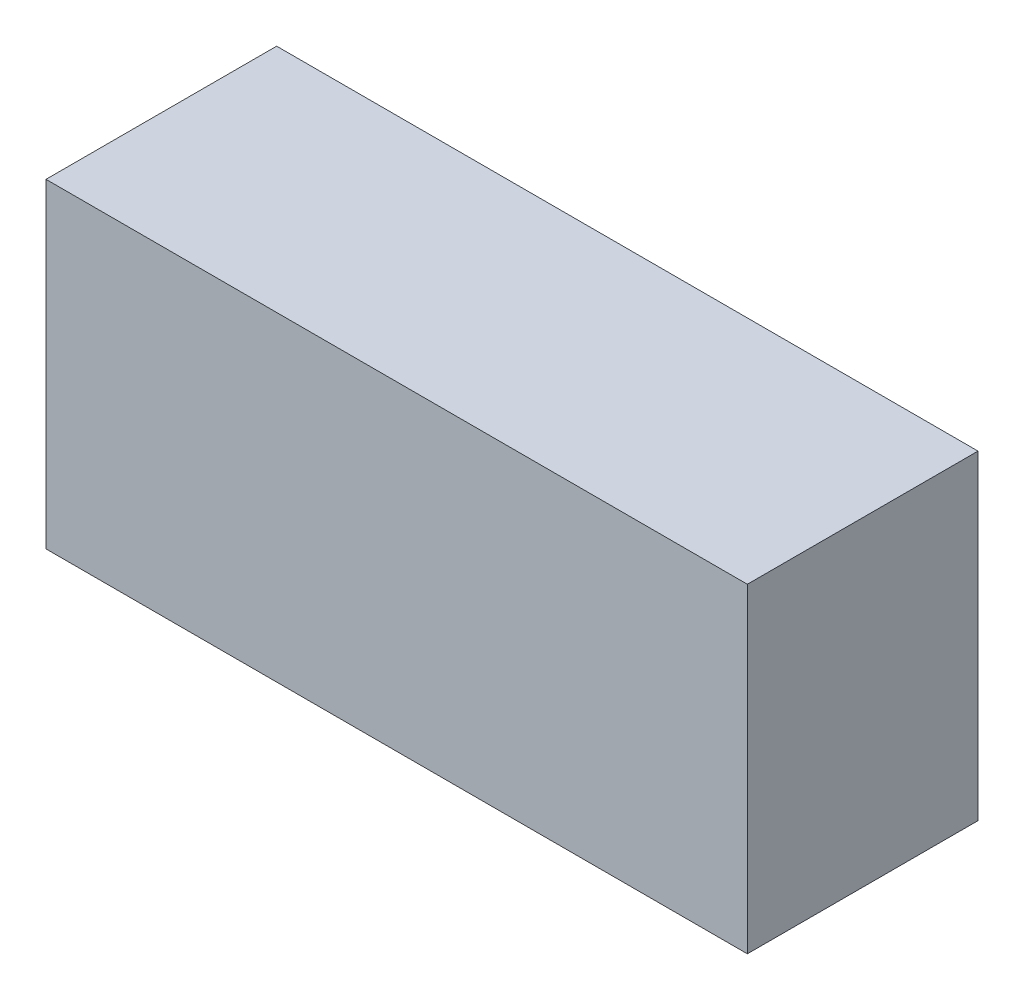
from build123d import *

# Parameters (mm, degrees)
SKETCH1_W           = 74.5
SKETCH1_H           = 24.5
BOSS_EXTRUDE1_DEPTH = 34


with BuildPart() as part:
    # Sketch1 → Boss-Extrude1 (new body)
    with BuildSketch(Plane(origin=(0, 0, 0), x_dir=(1, 0, 0), z_dir=(0, 1, 0))):
        Rectangle(SKETCH1_W, SKETCH1_H)
    extrude(amount=BOSS_EXTRUDE1_DEPTH)


solid = part.part
